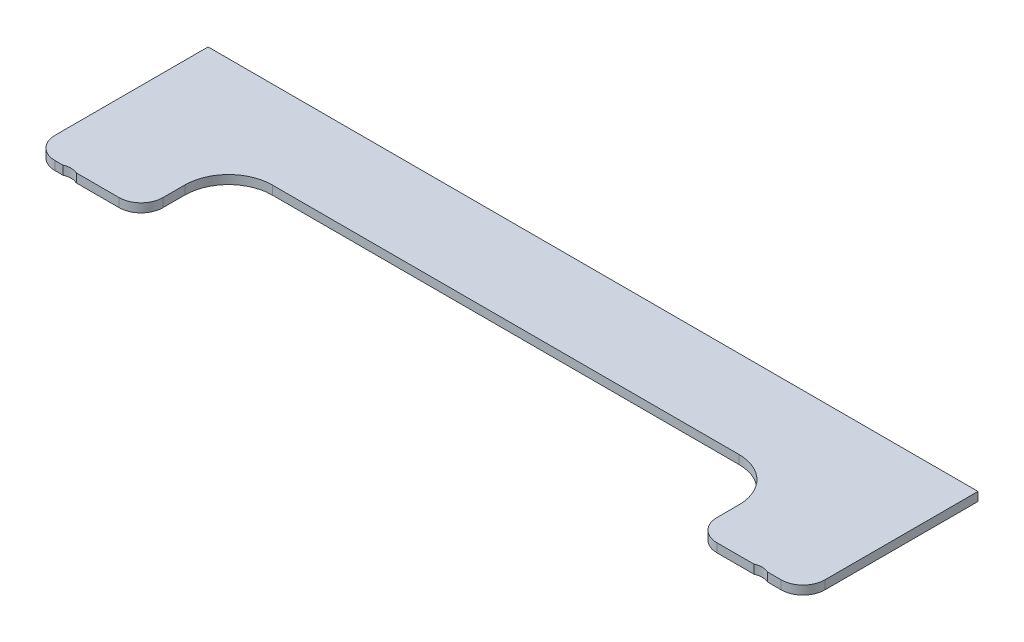
from build123d import *

# Parameters (mm, degrees)
EXTRUDE_1_DEPTH          = 6
CUT_EXTRUDE_1_DEPTH      = 14
CUT_EXTRUDE_1_DEPTH_BACK = 5
SKETCH_7_R               = 11
CUT_EXTRUDE_2_DEPTH      = 11
CUT_EXTRUDE_2_DEPTH_BACK = 5
SKETCH_8_R               = 11


with BuildPart() as part:
    # Эскиз1 → Бобышка-Вытянуть1 (new body)
    with BuildSketch(Plane(origin=(0, 0, 0), x_dir=(1, 0, 0), z_dir=(0, 1, 0))):
        with BuildLine():
            Line((-338.202898551, 15), (-338.202898551, 120))
            Line((-338.202898551, 120), (189.797101449, 120))
            Line((189.797101449, 120), (189.797101449, 15))
            ThreePointArc((189.797101449, 15), (185.403703167, 4.393398282), (174.797101449, 0))
            Line((174.797101449, 0), (130.797101449, 0))
            ThreePointArc((130.797101449, 0), (120.190499731, 4.393398282), (115.797101449, 15))
            Line((115.797101449, 15), (115.797101449, 30))
            ThreePointArc((115.797101449, 30), (107.010304885, 51.213203436), (85.797101449, 60))
            Line((85.797101449, 60), (-234.202898551, 60))
            ThreePointArc((-234.202898551, 60), (-255.416101986, 51.213203436), (-264.202898551, 30))
            Line((-264.202898551, 30), (-264.202898551, 15))
            ThreePointArc((-264.202898551, 15), (-268.596296833, 4.393398282), (-279.202898551, 0))
            Line((-279.202898551, 0), (-323.202898551, 0))
            ThreePointArc((-323.202898551, 0), (-333.809500269, 4.393398282), (-338.202898551, 15))
        make_face()
    extrude(amount=EXTRUDE_1_DEPTH)

    # Эскиз7 → Вырез-Вытянуть1 (cut, two sides: drawn at the far end of the back side and taken through both)
    with BuildSketch(Plane(origin=(0, 0, 0), x_dir=(1, 0, 0), z_dir=(0, 1, 0)).offset(-CUT_EXTRUDE_1_DEPTH_BACK)):
        with Locations((-313.202898551, -10)):
            Circle(SKETCH_7_R)
    extrude(amount=CUT_EXTRUDE_1_DEPTH + CUT_EXTRUDE_1_DEPTH_BACK, mode=Mode.SUBTRACT)

    # Эскиз8 → Вырез-Вытянуть2 (cut, two sides: drawn at the far end of the back side and taken through both)
    with BuildSketch(Plane(origin=(0, 0, 0), x_dir=(1, 0, 0), z_dir=(0, 1, 0)).offset(-CUT_EXTRUDE_2_DEPTH_BACK)):
        with Locations((160.797101449, -10)):
            Circle(SKETCH_8_R)
    extrude(amount=CUT_EXTRUDE_2_DEPTH + CUT_EXTRUDE_2_DEPTH_BACK, mode=Mode.SUBTRACT)


solid = part.part
